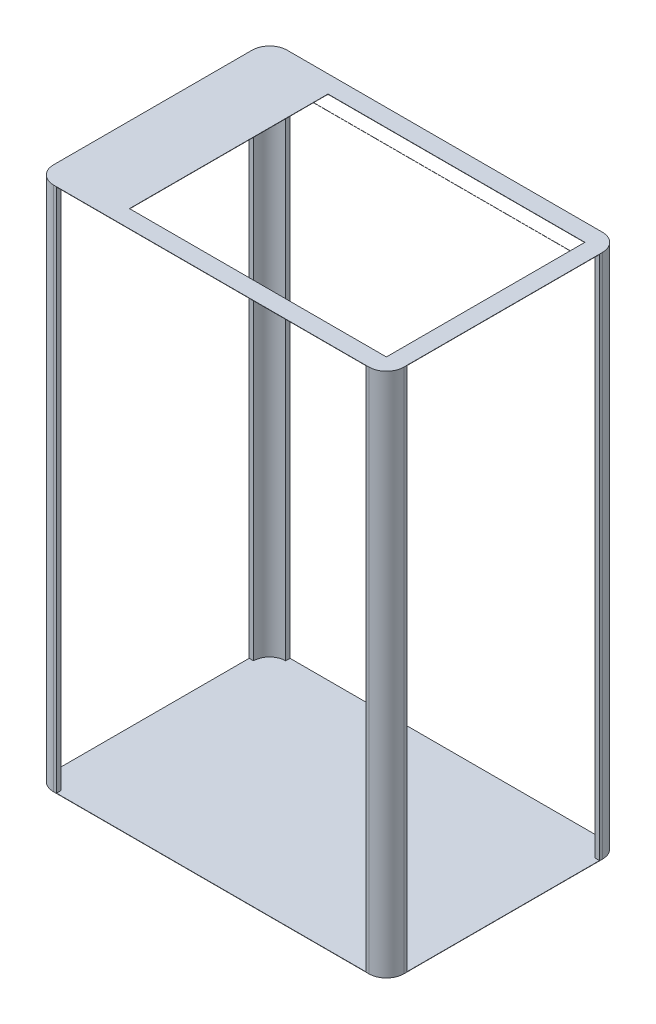
from build123d import *

# Parameters (mm, degrees)
BOSS_EXTRUDE1_DEPTH = 450
CUT_EXTRUDE1_DEPTH  = 449.5
SKETCH4_W           = 440
SKETCH4_H           = 340
CUT_EXTRUDE2_DEPTH  = 10
SKETCH7_R           = 0.125
BOSS_EXTRUDE2_DEPTH = 470


with BuildPart() as part:
    # Sketch2 → Boss-Extrude1 (new, symmetric)
    with BuildSketch(Plane(origin=(0, 0, 0), x_dir=(1, 0, 0), z_dir=(0, 1, 0))):
        with BuildLine():
            Line((-270, -200), (270, -200))
            ThreePointArc((270, -200), (291.213203436, -191.213203436), (300, -170))
            Line((300, -170), (300, 170))
            ThreePointArc((300, 170), (291.213203436, 191.213203436), (270, 200))
            Line((270, 200), (-270, 200))
            ThreePointArc((-270, 200), (-291.213203436, 191.213203436), (-300, 170))
            Line((-300, 170), (-300, -170))
            ThreePointArc((-300, -170), (-291.213203436, -191.213203436), (-270, -200))
        make_face()
    extrude(amount=BOSS_EXTRUDE1_DEPTH, both=True)

    # Sketch3 → Cut-Extrude1 (cut, symmetric)
    with BuildSketch(Plane(origin=(0, 0, 0), x_dir=(1, 0, 0), z_dir=(0, 1, 0))):
        with BuildLine():
            Line((-265, -200), (265, -200))
            Line((265, -200), (265, -192.5))
            ThreePointArc((265, -192.5), (284.445436483, -184.445436483), (292.5, -165))
            Line((292.5, -165), (300, -165))
            Line((300, -165), (300, 165))
            Line((300, 165), (292.5, 165))
            ThreePointArc((292.5, 165), (284.445436483, 184.445436483), (265, 192.5))
            Line((265, 192.5), (265, 200))
            Line((265, 200), (-265, 200))
            Line((-265, 200), (-265, 192.5))
            ThreePointArc((-265, 192.5), (-284.445436483, 184.445436483), (-292.5, 165))
            Line((-292.5, 165), (-300, 165))
            Line((-300, 165), (-300, -165))
            Line((-300, -165), (-292.5, -165))
            ThreePointArc((-292.5, -165), (-284.445436483, -184.445436483), (-265, -192.5))
            Line((-265, -192.5), (-265, -200))
        make_face()
    extrude(amount=CUT_EXTRUDE1_DEPTH, both=True, mode=Mode.SUBTRACT)

    # Sketch4 → Cut-Extrude2 (cut)
    with BuildSketch(Plane(origin=(0, 450, 0), x_dir=(1, 0, 0), z_dir=(0, 1, 0))):
        with Locations((50, 0)):
            Rectangle(SKETCH4_W, SKETCH4_H)
    extrude(amount=-CUT_EXTRUDE2_DEPTH, mode=Mode.SUBTRACT)

    # Sketch7 → Boss-Extrude2 (add)
    with BuildSketch(Plane(origin=(300, 0, 0), x_dir=(0, 0, -1), z_dir=(1, 0, 0))):
        with Locations((145, 449.75)):
            Circle(SKETCH7_R)
    extrude(amount=-BOSS_EXTRUDE2_DEPTH)


solid = part.part
